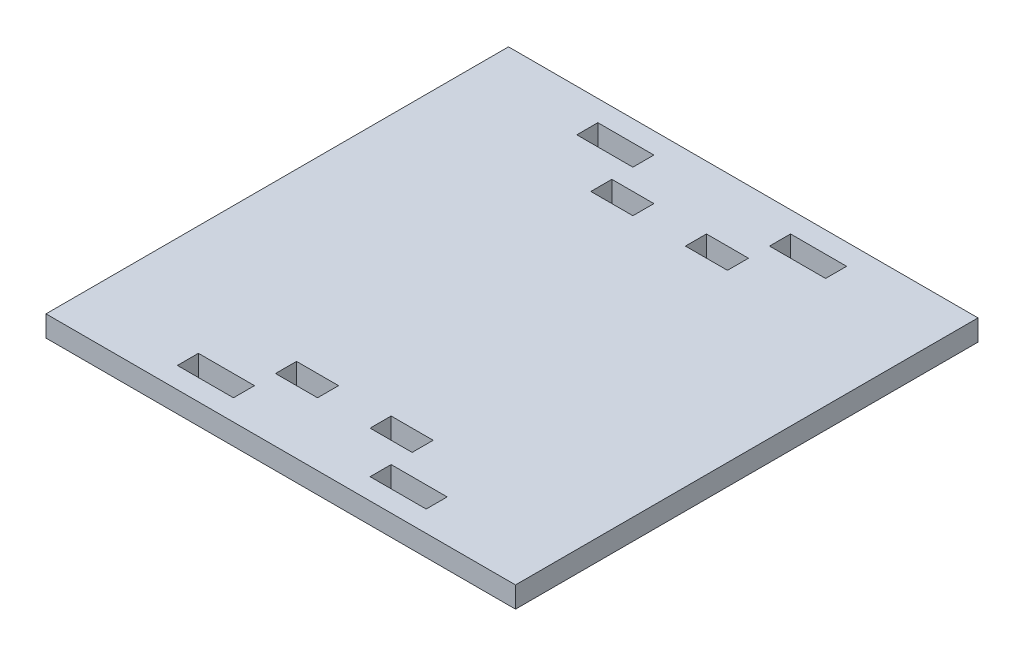
from build123d import *

# Parameters (mm, degrees)
ESBO_O1_W                = 6
ESBO_O1_H                = 3
RESSALTO_EXTRUS_O1_DEPTH = 3


with BuildPart() as part:
    # Esboço1 → Ressalto-extrusão1 (new body)
    with BuildSketch(Plane(origin=(0, 0, 0), x_dir=(1, 0, 0), z_dir=(0, 1, 0))):
        Polygon((-33.5, 28), (-33.5, -27.5), (-33.5, -28), (-33.5, -33), (-9.75, -33), (33.5, -33), (33.5, -28), (33.5, -27.5), (33.5, 28), (33.5, 33), (-9.75, 33), (-33.5, 33), align=None)
        Polygon((-16.929303449, -27), (-9.75, -27), (-9.75, -28.5), (-9.75, -30), (-17.75, -30), (-17.75, -27), align=None, mode=Mode.SUBTRACT)
        with Locations((-6.75, -22.5)):
            Rectangle(ESBO_O1_W, ESBO_O1_H, mode=Mode.SUBTRACT)
        Polygon((9.75, -28.5), (9.75, -27), (17.75, -27), (17.75, -30), (9.75, -30), align=None, mode=Mode.SUBTRACT)
        with Locations((6.75, -22.5)):
            Rectangle(ESBO_O1_W, ESBO_O1_H, mode=Mode.SUBTRACT)
        with Locations((-6.75, 22.5)):
            Rectangle(ESBO_O1_W, ESBO_O1_H, mode=Mode.SUBTRACT)
        Polygon((-9.75, 28.5), (-9.75, 27), (-16.929303449, 27), (-17.75, 27), (-17.75, 30), (-9.75, 30), align=None, mode=Mode.SUBTRACT)
        with Locations((6.75, 22.5)):
            Rectangle(ESBO_O1_W, ESBO_O1_H, mode=Mode.SUBTRACT)
        Polygon((9.75, 27), (9.75, 28.5), (9.75, 30), (17.75, 30), (17.75, 27), align=None, mode=Mode.SUBTRACT)
    extrude(amount=RESSALTO_EXTRUS_O1_DEPTH)


solid = part.part
